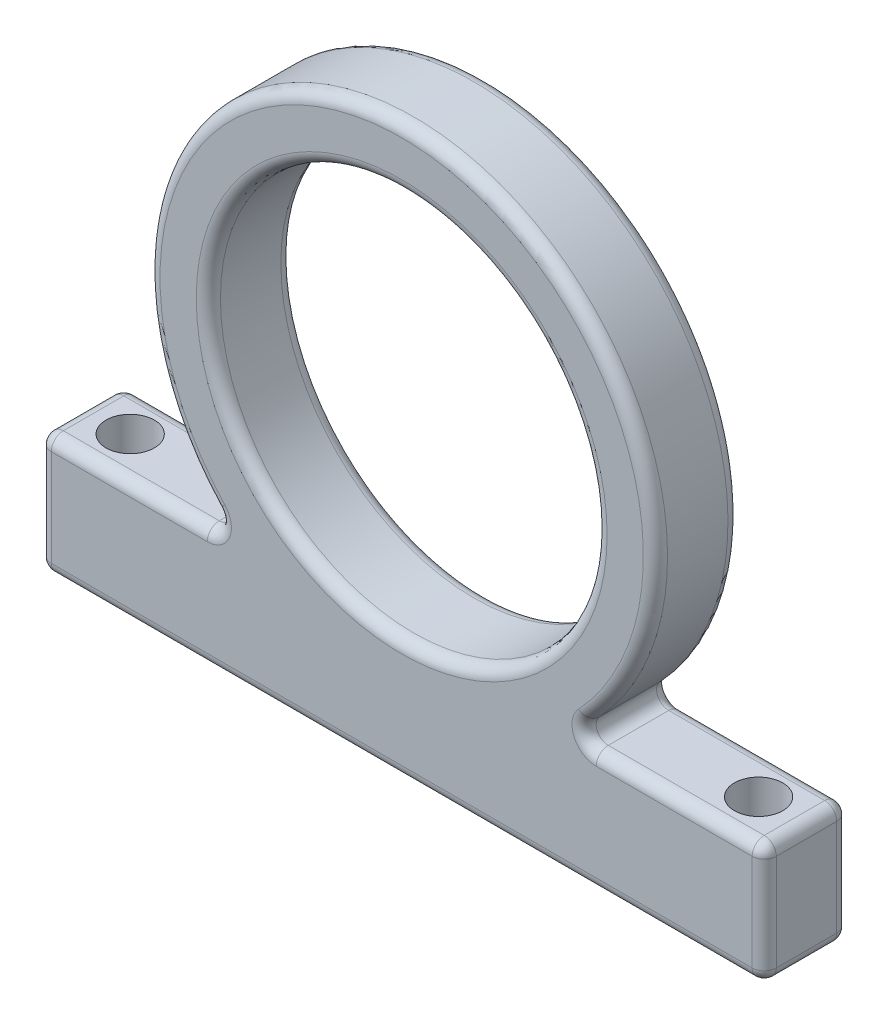
from build123d import *

# Parameters (mm, degrees)
SKETCH2_R           = 16
BOSS_EXTRUDE1_DEPTH = 7
FILLET2_R           = 1
FILLET3_R           = 1
SKETCH3_R           = 2
CUT_EXTRUDE1_DEPTH  = 100


with BuildPart() as part:
    # Sketch2 → Boss-Extrude1 (new body)
    with BuildSketch(Plane.XY):
        with BuildLine():
            Line((30, -16), (30, -26))
            Line((30, -26), (-30, -26))
            Line((-30, -26), (-30, -16))
            Line((-30, -16), (-13.601470509, -16))
            ThreePointArc((-13.601470509, -16), (0, 21), (13.601470509, -16))
            Line((13.601470509, -16), (30, -16))
        make_face()
        Circle(SKETCH2_R, mode=Mode.SUBTRACT)
    extrude(amount=BOSS_EXTRUDE1_DEPTH)

    # Fillet2
    fillet2_edges = [part.edges().sort_by_distance(p)[0] for p in [
        (-13.601470509, -16, 3.5),
        (13.601470509, -16, 3.5),
        (-21.800735254, -16, 7),
        (-16, 0, 0),
        (-16, 0, 7),
        (21.800735254, -16, 7),
        (-21.800735254, -16, 0),
        (0, 21, 0),
        (21.800735254, -16, 0),
        (0, 21, 7),
    ]]
    fillet(fillet2_edges, radius=FILLET2_R)

    # Fillet3
    fillet3_edges = [part.edges().sort_by_distance(p)[0] for p in [
        (30, -26, 3.5),
        (-30, -26, 3.5),
        (0, -26, 7),
        (-30, -21.5, 7),
        (30, -21.5, 7),
        (30, -16, 3.5),
        (30, -16.292893219, 0.292893219),
        (30, -16.292893219, 6.707106781),
        (-30, -21.5, 0),
        (-30, -16, 3.5),
        (-30, -16.292893219, 0.292893219),
        (-30, -16.292893219, 6.707106781),
        (30, -21.5, 0),
        (0, -26, 0),
    ]]
    fillet(fillet3_edges, radius=FILLET3_R)

    # Sketch3 → Cut-Extrude1 (cut)
    with BuildSketch(Plane(origin=(0, -16, 0), x_dir=(1, 0, 0), z_dir=(0, 1, 0))):
        with Locations(Location((-26, -3.46767138, 0), (0, 0, 270))):
            Circle(SKETCH3_R)
        with Locations(Location((26, -3.46767138, 0), (0, 0, 270))):
            Circle(SKETCH3_R)
    extrude(amount=-CUT_EXTRUDE1_DEPTH, mode=Mode.SUBTRACT)


solid = part.part
